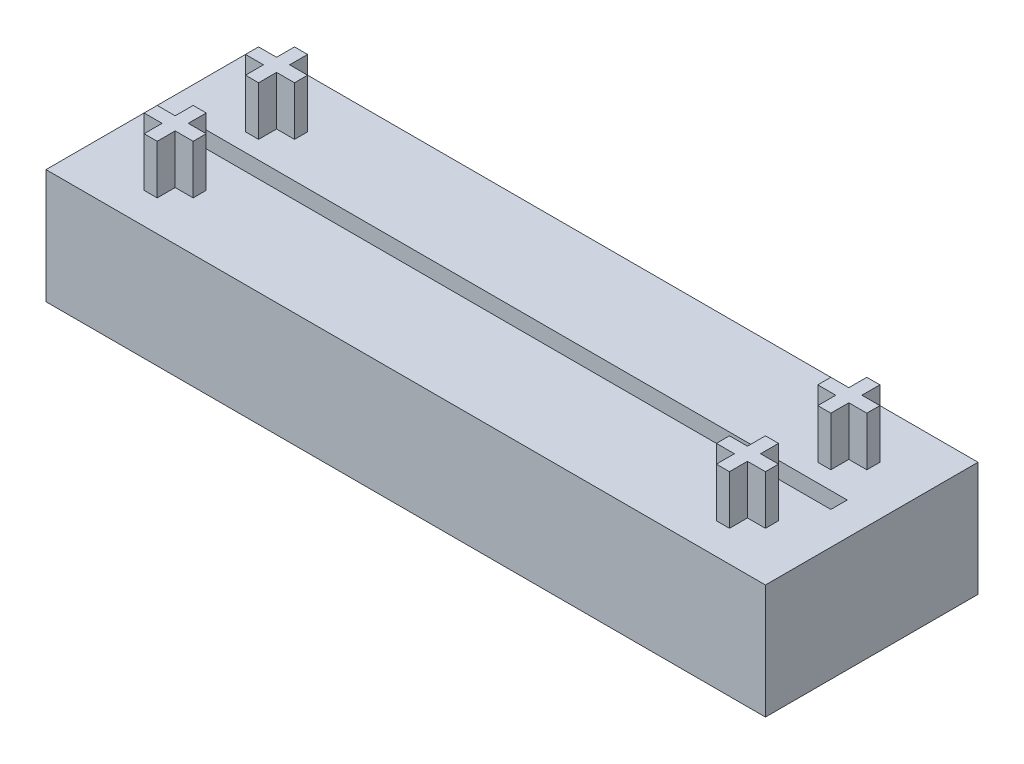
from build123d import *

# Parameters (mm, degrees)
SKICA1_W                = 220
SKICA1_H                = 65
SKICA1_W_2              = 200
SKICA1_H_2              = 5
P_IDAT_VYSUNUT_M1_DEPTH = 35
P_IDAT_VYSUNUT_M2_DEPTH = 15


with BuildPart() as part:
    # Skica1 → Přidat vysunutím1 (new body)
    with BuildSketch(Plane(origin=(0, 0, 0), x_dir=(1, 0, 0), z_dir=(0, 1, 0))):
        with Locations((110, 32.5)):
            Rectangle(SKICA1_W, SKICA1_H)
        with Locations((110, 32.5)):
            Rectangle(SKICA1_W_2, SKICA1_H_2, mode=Mode.SUBTRACT)
    extrude(amount=P_IDAT_VYSUNUT_M1_DEPTH)

    # Skica2 → Přidat vysunutím2 (add)
    with BuildSketch(Plane(origin=(0, 35, 0), x_dir=(1, 0, 0), z_dir=(0, 1, 0))):
        Polygon((15, 15), (15, 19), (20.5, 19), (20.5, 24.5), (24.5, 24.5), (24.5, 19), (30, 19), (30, 15), (24.5, 15), (24.5, 9.5), (20.5, 9.5), (20.5, 15), align=None)
        Polygon((24.5, 50), (30, 50), (30, 46), (24.5, 46), (24.5, 40.5), (20.5, 40.5), (20.5, 46), (15, 46), (15, 50), (20.5, 50), (20.5, 55.5), (24.5, 55.5), align=None)
        Polygon((205, 50), (205, 46), (199.5, 46), (199.5, 40.5), (195.5, 40.5), (195.5, 46), (190, 46), (190, 50), (195.5, 50), (195.5, 55.5), (199.5, 55.5), (199.5, 50), align=None)
        Polygon((205, 15), (199.5, 15), (199.5, 9.5), (195.5, 9.5), (195.5, 15), (190, 15), (190, 19), (195.5, 19), (195.5, 24.5), (199.5, 24.5), (199.5, 19), (205, 19), align=None)
    extrude(amount=P_IDAT_VYSUNUT_M2_DEPTH)


solid = part.part
